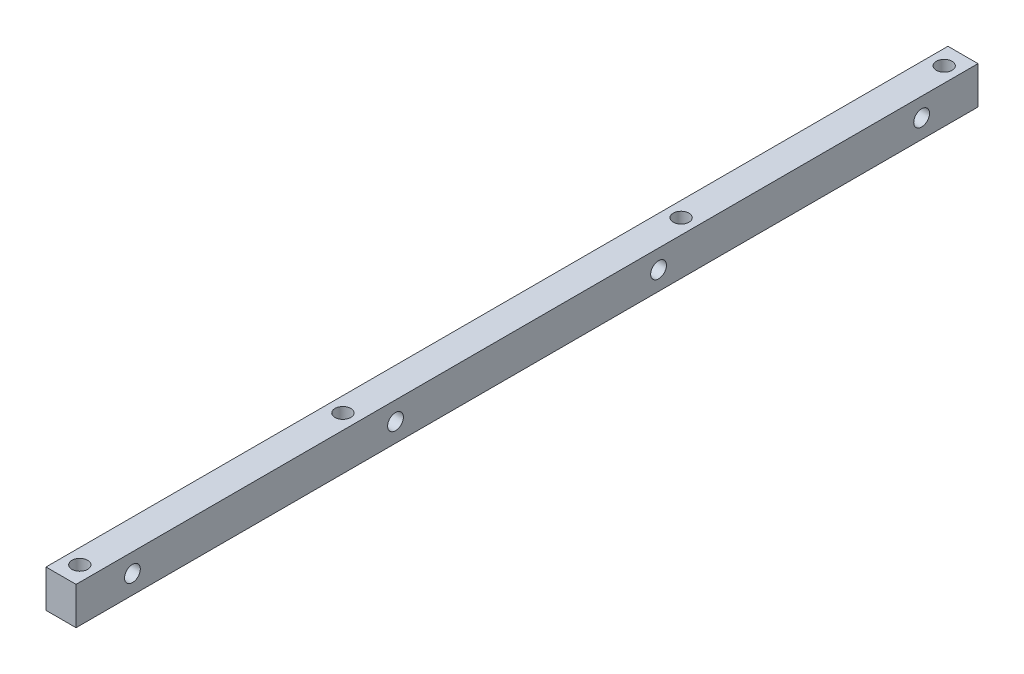
from build123d import *

# Parameters (mm, degrees)
AUFSATZ_LINEAR_AUSTRAGEN1_DEPTH           = 120
AUFSATZ_LINEAR_AUSTRAGEN1_DEPTH_BACK      = 120
SKIZZE1_W                                 = 8
SKIZZE1_H                                 = 10
M5_GEWINDEBOHRUNG1_D                      = 4.2
F_4_2_4_2_DURCHMESSER_BOHRUNG1_AT_2_COUNT = 2
F_4_2_4_2_DURCHMESSER_BOHRUNG1_AT_2_PITCH = 70


with BuildPart() as part:
    # Skizze1 → Aufsatz-Linear austragen1 (new, two sides: drawn at the far end of the back side and taken through both)
    with BuildSketch(Plane.XY.offset(-AUFSATZ_LINEAR_AUSTRAGEN1_DEPTH_BACK)):
        Rectangle(SKIZZE1_W, SKIZZE1_H)
    extrude(amount=AUFSATZ_LINEAR_AUSTRAGEN1_DEPTH + AUFSATZ_LINEAR_AUSTRAGEN1_DEPTH_BACK)

    # M5 Gewindebohrung1 (through all)
    with Locations(Plane(origin=(0, 5, 0), x_dir=(1, 0, 0), z_dir=(0, 1, 0))):
        with Locations((0, -115), (0, -45)):
            m5_gewindebohrung1 = Hole(M5_GEWINDEBOHRUNG1_D / 2)

    # Skizze4 → Ø4.2 (4.2) Durchmesser Bohrung1 (revolve, cut)
    with BuildSketch(Plane(origin=(-4, 0, 105), x_dir=(0, 0, 1), z_dir=(0, 1, 0))):
        Polygon((0, 0), (0, 11.2618073), (2.1, 10), (2.1, 0), align=None)
    f_4_2_4_2_durchmesser_bohrung1 = revolve(axis=Axis((-10.35, 0, 105), (1, 0, 0)), mode=Mode.SUBTRACT)

    # Ø4.2 (4.2) Durchmesser Bohrung1 at 2: Ø4.2 (4.2) Durchmesser Bohrung1 ×2
    with Locations(*[(0, 0, -i * F_4_2_4_2_DURCHMESSER_BOHRUNG1_AT_2_PITCH) for i in range(1, F_4_2_4_2_DURCHMESSER_BOHRUNG1_AT_2_COUNT)]):
        add(f_4_2_4_2_durchmesser_bohrung1, mode=Mode.SUBTRACT)

    # Spiegeln1: M5 Gewindebohrung1, Ø4.2 (4.2) Durchmesser Bohrung1 across plane
    add(m5_gewindebohrung1.mirror(Plane.XY), mode=Mode.SUBTRACT)
    add(f_4_2_4_2_durchmesser_bohrung1.mirror(Plane.XY), mode=Mode.SUBTRACT)

    # Spiegeln1 copy 1 sketch → Spiegeln1 copy 1 (revolve, cut)
    with BuildSketch(Plane(origin=(-4, 0, -35), x_dir=(0, 0, -1), z_dir=(0, 1, 0))):
        Polygon((0, 0), (0, -11.2618073), (2.1, -10), (2.1, 0), align=None)
    revolve(axis=Axis((-10.35, 0, -35), (-1, 0, 0)), mode=Mode.SUBTRACT)


solid = part.part
